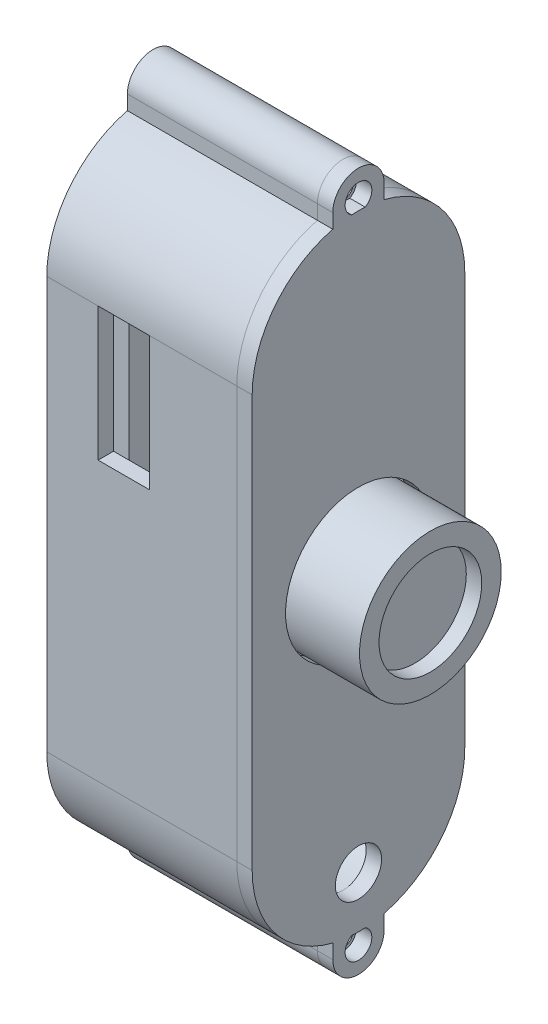
from build123d import *

# Parameters (mm, degrees)
BOSS_EXTRUDE1_DEPTH = 13.5
CUT_EXTRUDE1_DEPTH  = 12
SKETCH3_R           = 1.6
SKETCH3_R_2         = 1
SKETCH3_R_3         = 2.5
SKETCH3_W           = 7
SKETCH3_H           = 3.5
BOSS_EXTRUDE2_DEPTH = 3
SKETCH5_R           = 7.1
BOSS_EXTRUDE3_DEPTH = 1.5
BOSS_EXTRUDE4_DEPTH = 3.5
SKETCH8_R           = 2.25
CUT_EXTRUDE3_DEPTH  = 1.5
CUT_EXTRUDE4_REACH  = 58.557
SKETCH9_W           = 5
SKETCH9_H           = 13
BOSS_EXTRUDE5_START = -13.5
SKETCH10_R          = 1
BOSS_EXTRUDE5_DEPTH = 13.5
BOSS_EXTRUDE6_START = -1.5
SKETCH11_R          = 2.25
SKETCH11_R_2        = 7.1
SKETCH11_R_3        = 1.3
BOSS_EXTRUDE6_DEPTH = 1.5
SKETCH12_R          = 6.9
BOSS_EXTRUDE7_DEPTH = 20.5
SKETCH13_R          = 5
CUT_EXTRUDE5_DEPTH  = 1.5
BOSS_EXTRUDE8_START = 5
BOSS_EXTRUDE8_DEPTH = 5
SKETCH17_R          = 1.475
CUT_EXTRUDE6_DEPTH  = 5


with BuildPart() as part:
    # Sketch1 → Boss-Extrude1 (new body)
    with BuildSketch(Plane.YZ):
        with BuildLine():
            Line((0, 0), (40.1, 0))
            ThreePointArc((40.1, 0), (50.45, 10.35), (40.1, 20.7))
            Line((40.1, 20.7), (0, 20.7))
            ThreePointArc((0, 20.7), (-10.35, 10.35), (0, 0))
        make_face()
    extrude(amount=BOSS_EXTRUDE1_DEPTH)

    # Sketch2 → Cut-Extrude1 (cut)
    with BuildSketch(Plane.YZ.offset(13.5)):
        with BuildLine():
            Line((40.1, 19.2), (0, 19.2))
            ThreePointArc((0, 19.2), (-8.85, 10.35), (0, 1.5))
            Line((0, 1.5), (40.1, 1.5))
            ThreePointArc((40.1, 1.5), (48.95, 10.35), (40.1, 19.2))
        make_face()
    extrude(amount=-CUT_EXTRUDE1_DEPTH, mode=Mode.SUBTRACT)

    # Sketch3 → Boss-Extrude2 (add)
    # profile 1 of 3: a face of its own
    with BuildSketch(Plane.YZ.offset(1.5)):
        with Locations(Location((0.92, 10.35, 0), (0, 0, 270))):
            Circle(SKETCH3_R)
        with Locations(Location((0.92, 10.35, 0), (0, 0, 270))):
            Circle(SKETCH3_R_2, mode=Mode.SUBTRACT)
    # profile 2 of 3: a face of its own
    with BuildSketch(Plane.YZ.offset(1.5)):
        with Locations(Location((43.92, 10.35, 0), (0, 0, 270))):
            Circle(SKETCH3_R_3)
        with Locations(Location((43.92, 10.35, 0), (0, 0, 270))):
            Circle(SKETCH3_R_2, mode=Mode.SUBTRACT)
    # profile 3 of 3: a face of its own
    with BuildSketch(Plane.YZ.offset(1.5)):
        with Locations((20.05, 17.45)):
            Rectangle(SKETCH3_W, SKETCH3_H)
    extrude(amount=BOSS_EXTRUDE2_DEPTH)

    # Cut-Extrude4: up to this face of the body (flat: up to its plane)
    cut_extrude4_end = Plane(part.part.faces().sort_by_distance((7.705345502, 20.05, 19.2))[0])
    # Sketch9 → Cut-Extrude4 (cut, up to the picked face)
    with BuildSketch(Plane.XY.offset(20.7), mode=Mode.PRIVATE) as cut_extrude4_sk1:
        with Locations((2.5, 33.6)):
            Rectangle(SKETCH9_W, SKETCH9_H)
    cut_extrude4_tool1 = split(extrude(cut_extrude4_sk1.sketch, amount=-CUT_EXTRUDE4_REACH, mode=Mode.PRIVATE), bisect_by=cut_extrude4_end, keep=Keep.BOTH, mode=Mode.PRIVATE)
    add(cut_extrude4_tool1.solids().sort_by(Axis((2.5, 33.6, 20.7), (0, 0, -1)))[0], mode=Mode.SUBTRACT)

    # Sketch10 → Boss-Extrude5 (add)
    # profile 1 of 2: a face of its own
    with BuildSketch(Plane(origin=(0, 0, 0), x_dir=(0, -1, 0), z_dir=(-1, 0, 0)).offset(BOSS_EXTRUDE5_START)):
        with BuildLine():
            Line((11.45, 7.85), (10.043530256, 7.85))
            ThreePointArc((10.043530256, 7.85), (10.088482115, 8.038068207), (10.129912664, 8.226943377))
            ThreePointArc((10.129912664, 8.226943377), (8.95, 10.35), (10.129912664, 12.473056623))
            ThreePointArc((10.129912664, 12.473056623), (10.088482115, 12.661931793), (10.043530256, 12.85))
            Line((10.043530256, 12.85), (11.45, 12.85))
            ThreePointArc((11.45, 12.85), (13.95, 10.35), (11.45, 7.85))
        make_face()
        with Locations(Location((11.45, 10.35, 0), (0, 0, 270))):
            Circle(SKETCH10_R, mode=Mode.SUBTRACT)
    # profile 2 of 2: a face of its own
    with BuildSketch(Plane(origin=(0, 0, 0), x_dir=(0, -1, 0), z_dir=(-1, 0, 0)).offset(BOSS_EXTRUDE5_START)):
        with BuildLine():
            Line((-51.55, 12.85), (-50.143530256, 12.85))
            ThreePointArc((-50.143530256, 12.85), (-50.188482115, 12.661931793), (-50.229912664, 12.473056623))
            ThreePointArc((-50.229912664, 12.473056623), (-49.05, 10.35), (-50.229912664, 8.226943377))
            ThreePointArc((-50.229912664, 8.226943377), (-50.188482115, 8.038068207), (-50.143530256, 7.85))
            Line((-50.143530256, 7.85), (-51.55, 7.85))
            ThreePointArc((-51.55, 7.85), (-54.05, 10.35), (-51.55, 12.85))
        make_face()
        with Locations(Location((-51.55, 10.35, 0), (0, 0, 90))):
            Circle(SKETCH10_R, mode=Mode.SUBTRACT)
    extrude(amount=BOSS_EXTRUDE5_DEPTH)

    # Sketch16 → Boss-Extrude8 (add)
    with BuildSketch(Plane(origin=(0, 0, 0), x_dir=(0, -1, 0), z_dir=(-1, 0, 0)).offset(BOSS_EXTRUDE8_START)):
        with BuildLine():
            Line((-40.1, 20.7), (-27.1, 20.7))
            Line((-27.1, 20.7), (0, 20.7))
            ThreePointArc((0, 20.7), (6.373676333, 18.504676572), (10.043530256, 12.85))
            Line((10.043530256, 12.85), (11.45, 12.85))
            ThreePointArc((11.45, 12.85), (13.95, 10.35), (11.45, 7.85))
            Line((11.45, 7.85), (10.043530256, 7.85))
            ThreePointArc((10.043530256, 7.85), (6.373676333, 2.195323428), (0, 0))
            Line((0, 0), (-40.1, 0))
            ThreePointArc((-40.1, 0), (-46.473676333, 2.195323428), (-50.143530256, 7.85))
            Line((-50.143530256, 7.85), (-51.55, 7.85))
            ThreePointArc((-51.55, 7.85), (-54.05, 10.35), (-51.55, 12.85))
            Line((-51.55, 12.85), (-50.143530256, 12.85))
            ThreePointArc((-50.143530256, 12.85), (-46.473676333, 18.504676572), (-40.1, 20.7))
        make_face()
    extrude(amount=-BOSS_EXTRUDE8_DEPTH)

    # Sketch17 → Cut-Extrude6 (cut)
    with BuildSketch(Plane(origin=(-5, 0, 0), x_dir=(0, -1, 0), z_dir=(-1, 0, 0))):
        with Locations(Location((-35.05, 10.35, 0), (0, 0, 90))):
            Circle(SKETCH17_R)
        with Locations(Location((-5.05, 10.35, 0), (0, 0, 90))):
            Circle(SKETCH17_R)
    extrude(amount=-CUT_EXTRUDE6_DEPTH, mode=Mode.SUBTRACT)


with BuildPart() as body_2:
    # Sketch5 → Boss-Extrude3 (new body)
    with BuildSketch(Plane.YZ.offset(13.5)):
        with BuildLine():
            Line((40.1, 20.7), (0, 20.7))
            ThreePointArc((0, 20.7), (-10.35, 10.35), (0, 0))
            Line((0, 0), (40.1, 0))
            ThreePointArc((40.1, 0), (50.45, 10.35), (40.1, 20.7))
        make_face()
        with Locations(Location((20.05, 10.35, 0), (0, 0, 270))):
            Circle(SKETCH5_R, mode=Mode.SUBTRACT)
    extrude(amount=BOSS_EXTRUDE3_DEPTH)

    # Sketch6 → Boss-Extrude4 (add)
    with BuildSketch(Plane(origin=(13.5, 0, 0), x_dir=(0, -1, 0), z_dir=(-1, 0, 0))):
        with BuildLine():
            Line((-40.1, 19.2), (0, 19.2))
            ThreePointArc((0, 19.2), (8.85, 10.35), (0, 1.5))
            Line((0, 1.5), (-40.1, 1.5))
            ThreePointArc((-40.1, 1.5), (-48.95, 10.35), (-40.1, 19.2))
        make_face()
        with BuildLine():
            Line((-40.1, 18), (0, 18))
            ThreePointArc((0, 18), (7.65, 10.35), (0, 2.7))
            Line((0, 2.7), (-40.1, 2.7))
            ThreePointArc((-40.1, 2.7), (-47.75, 10.35), (-40.1, 18))
        make_face(mode=Mode.SUBTRACT)
    extrude(amount=BOSS_EXTRUDE4_DEPTH)

    # Sketch8 → Cut-Extrude3 (cut)
    with BuildSketch(Plane.YZ.offset(15)):
        with Locations(Location((-5.35, 10.35, 0), (0, 0, 270))):
            Circle(SKETCH8_R)
    extrude(amount=-CUT_EXTRUDE3_DEPTH, mode=Mode.SUBTRACT)

    # Sketch11 → Boss-Extrude6 (add)
    with BuildSketch(Plane.YZ.offset(15).offset(BOSS_EXTRUDE6_START)):
        with BuildLine():
            Line((50.143530256, 7.85), (51.55, 7.85))
            ThreePointArc((51.55, 7.85), (54.05, 10.35), (51.55, 12.85))
            Line((51.55, 12.85), (50.143530256, 12.85))
            ThreePointArc((50.143530256, 12.85), (46.473676333, 18.504676572), (40.1, 20.7))
            Line((40.1, 20.7), (0, 20.7))
            ThreePointArc((0, 20.7), (-6.373676333, 18.504676572), (-10.043530256, 12.85))
            Line((-10.043530256, 12.85), (-11.45, 12.85))
            ThreePointArc((-11.45, 12.85), (-13.95, 10.35), (-11.45, 7.85))
            Line((-11.45, 7.85), (-10.043530256, 7.85))
            ThreePointArc((-10.043530256, 7.85), (-6.373676333, 2.195323428), (0, 0))
            Line((0, 0), (40.1, 0))
            ThreePointArc((40.1, 0), (46.473676333, 2.195323428), (50.143530256, 7.85))
        make_face()
        with Locations(Location((-5.35, 10.35, 0), (0, 0, 270))):
            Circle(SKETCH11_R, mode=Mode.SUBTRACT)
        with Locations(Location((20.05, 10.35, 0), (0, 0, 270))):
            Circle(SKETCH11_R_2, mode=Mode.SUBTRACT)
        with Locations((-11.45, 10.35)):
            Circle(SKETCH11_R_3, mode=Mode.SUBTRACT)
        with Locations((51.55, 10.35)):
            Circle(SKETCH11_R_3, mode=Mode.SUBTRACT)
    extrude(amount=BOSS_EXTRUDE6_DEPTH)


with BuildPart() as body_3:
    # Sketch12 → Boss-Extrude7 (new body)
    with BuildSketch(Plane(origin=(1.5, 0, 0), x_dir=(0, 0, -1), z_dir=(1, 0, 0))):
        with Locations((-10.35, 20.05)):
            Circle(SKETCH12_R)
    extrude(amount=BOSS_EXTRUDE7_DEPTH)

    # Sketch13 → Cut-Extrude5 (cut)
    with BuildSketch(Plane.YZ.offset(22)):
        with Locations(Location((20.05, 10.35, 0), (0, 0, 270))):
            Circle(SKETCH13_R)
    extrude(amount=-CUT_EXTRUDE5_DEPTH, mode=Mode.SUBTRACT)


solid = Compound([part.part, body_2.part, body_3.part])
